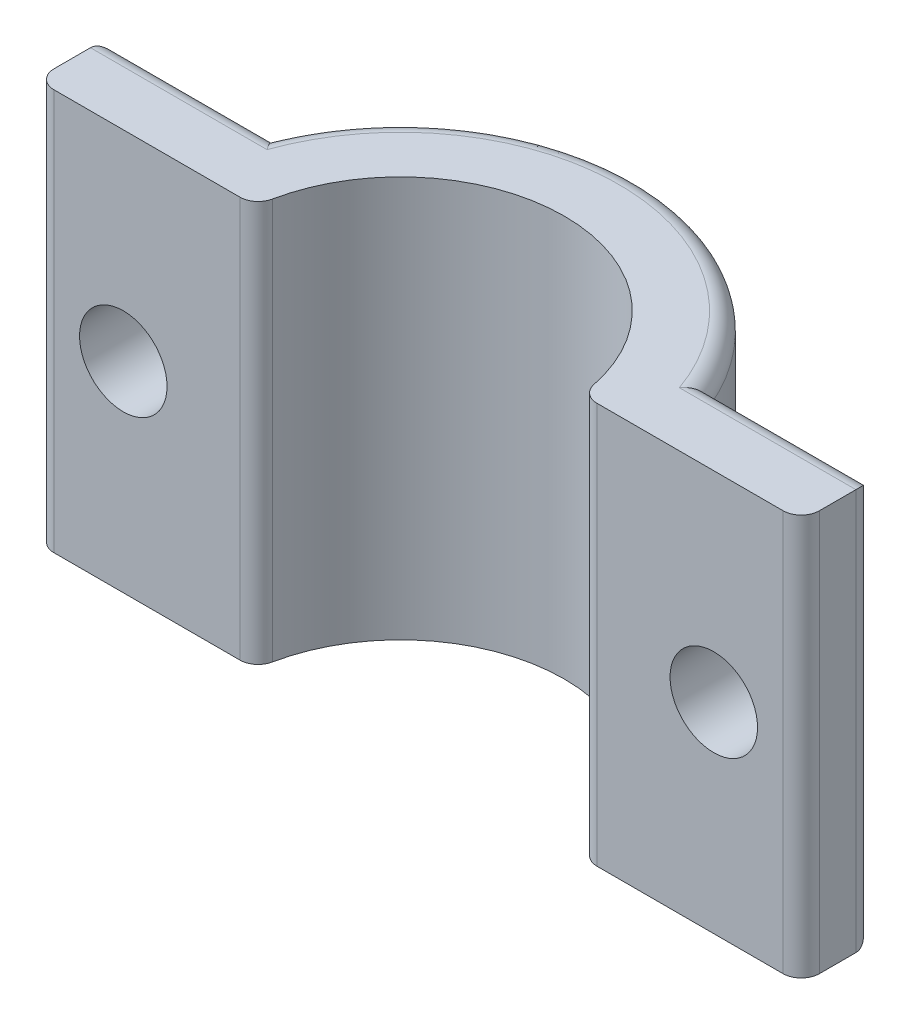
from build123d import *

# Parameters (mm, degrees)
BOSS_EXTRUDE1_DEPTH = 11
SKETCH2_R           = 1.2
CUT_EXTRUDE1_DEPTH  = 2
FILLET1_R           = 0.5


with BuildPart() as part:
    # Sketch1 → Boss-Extrude1 (new body)
    with BuildSketch(Plane(origin=(0, 0, 0), x_dir=(1, 0, 0), z_dir=(0, 1, 0))):
        with BuildLine():
            Line((6, 2.5), (10.5, 2.5))
            Line((10.5, 2.5), (10.5, 0.5))
            Line((10.5, 0.5), (6.480740698, 0.5))
            Line((6.480740698, 0.5), (4.472135955, 0.5))
            ThreePointArc((4.472135955, 0.5), (0, 4.5), (-4.472135955, 0.5))
            Line((-4.472135955, 0.5), (-6.480740698, 0.5))
            Line((-6.480740698, 0.5), (-10.5, 0.5))
            Line((-10.5, 0.5), (-10.5, 2.5))
            Line((-10.5, 2.5), (-6, 2.5))
            ThreePointArc((-6, 2.5), (0, 6.5), (6, 2.5))
        make_face()
    extrude(amount=BOSS_EXTRUDE1_DEPTH)

    # Sketch2 → Cut-Extrude1 (cut)
    with BuildSketch(Plane(origin=(0, 0, -2.5), x_dir=(-1, 0, 0), z_dir=(0, 0, -1))):
        with Locations((-8.1, 5.5)):
            Circle(SKETCH2_R)
        with Locations((8.1, 5.5)):
            Circle(SKETCH2_R)
    extrude(amount=-CUT_EXTRUDE1_DEPTH, mode=Mode.SUBTRACT)

    # Fillet1
    fillet1_edges = [part.edges().sort_by_distance(p)[0] for p in [
        (0, 11, -6.5),
        (-8.25, 0, -2.5),
        (0, 0, -6.5),
        (8.25, 0, -2.5),
        (-8.25, 11, -2.5),
        (10.5, 5.5, -2.5),
        (10.5, 5.5, -0.5),
        (4.472135955, 5.5, -0.5),
        (-4.472135955, 5.5, -0.5),
        (-10.5, 5.5, -0.5),
        (-10.5, 5.5, -2.5),
        (8.25, 11, -2.5),
    ]]
    fillet(fillet1_edges, radius=FILLET1_R)


solid = part.part
